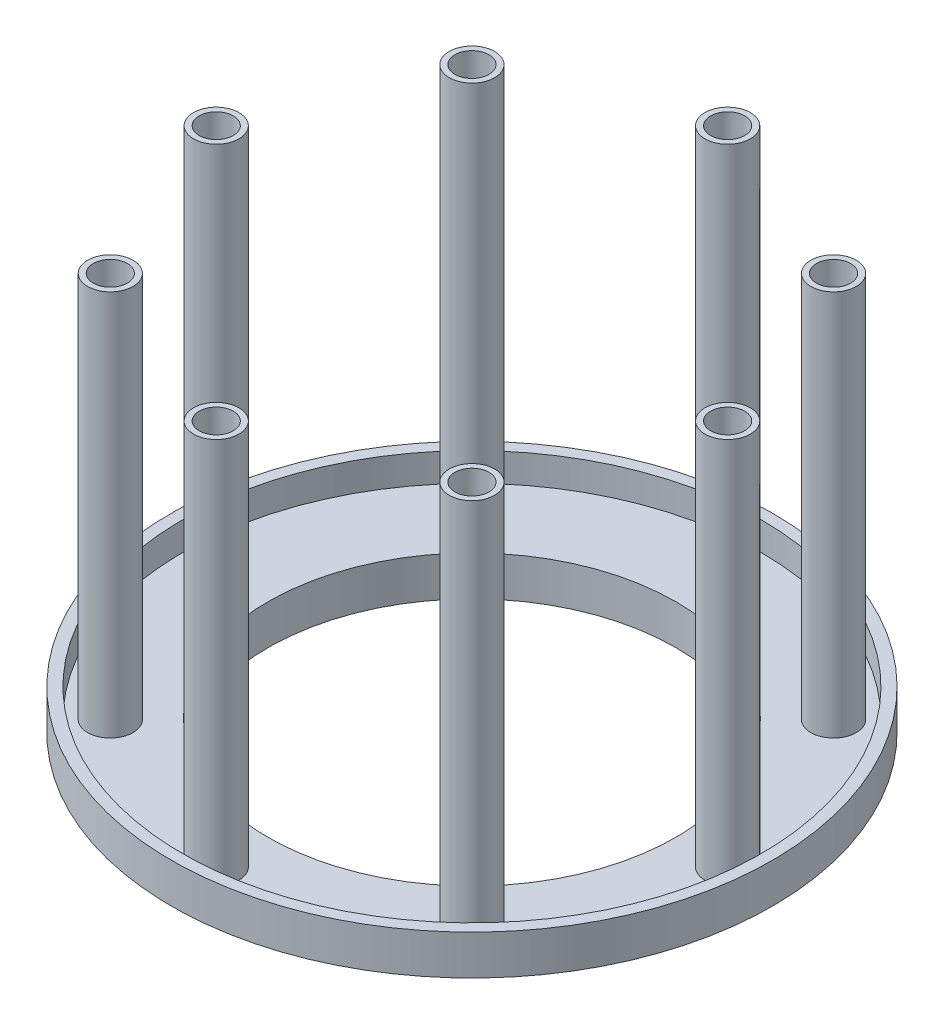
from build123d import *

# Parameters (mm, degrees)
IZIM2_R                        = 4
KES_EKSTR_ZYON1_DEPTH          = 10
PAH1_SIZE                      = 0.5
DAIRESEL_KAPLAMA8_COUNT        = 8
PAH1_OF_DAIRESEL_KAPLAMA8_SIZE = 0.5
IZIM4_R                        = 4
IZIM4_R_2                      = 3
Y_KSEKLIK_EKSTR_ZYON2_DEPTH    = 70


with BuildPart() as part:
    # Çizim1 → Döndür1 (revolve)
    with BuildSketch(Plane.XY, mode=Mode.PRIVATE) as d_nd_r1_sk:
        Polygon((-52.9, 7), (-52.9, 0), (-37.9, 0), (-37.9, -5), (-35.9, -5), (-35.9, 2), (-50.9, 2), (-50.9, 7), align=None)
    revolve(d_nd_r1_sk.sketch.rotate(Axis((0, 0, 0), (0, 1, 0)), 270), axis=Axis((0, 0, 0), (0, 1, 0)))

    # Çizim2 → Kes-Ekstrüzyon1 (cut)
    with BuildSketch(Plane.XZ):
        with Locations(Location((0, 45, 0), (0, 0, 270))):
            Circle(IZIM2_R)
    kes_ekstr_zyon1 = extrude(amount=-KES_EKSTR_ZYON1_DEPTH, mode=Mode.SUBTRACT)

    # Pah1
    pah1_edges = [part.edges().sort_by_distance(p)[0] for p in [
        (0, 0, 49),
    ]]
    chamfer(pah1_edges, length=PAH1_SIZE)

    # Dairesel Kaplama8: Kes-Ekstrüzyon1 ×8 about axis
    dairesel_kaplama8_axis = Axis((0, 0, 0), (0, 1, 0))
    for i in range(1, DAIRESEL_KAPLAMA8_COUNT):
        add(kes_ekstr_zyon1.rotate(dairesel_kaplama8_axis, i * 360 / DAIRESEL_KAPLAMA8_COUNT), mode=Mode.SUBTRACT)

    # Pah1 of Dairesel Kaplama8
    pah1_of_dairesel_kaplama8_edges = [part.edges().sort_by_distance(p)[0] for p in [
        (34.648232278, 0, 34.648232278),
        (49, 0, 0),
        (34.648232278, 0, -34.648232278),
        (0, 0, -49),
        (-34.648232278, 0, -34.648232278),
        (-49, 0, 0),
        (-34.648232278, 0, 34.648232278),
    ]]
    chamfer(pah1_of_dairesel_kaplama8_edges, length=PAH1_OF_DAIRESEL_KAPLAMA8_SIZE)

    # Çizim4 → Yükseklik-Ekstrüzyon2 (add)
    # profile 1 of 8: a face of its own
    with BuildSketch(Plane.XZ):
        with Locations(Location((0, 45, 0), (0, 0, 270))):
            Circle(IZIM4_R)
        with Locations(Location((0, 45, 0), (0, 0, 270))):
            Circle(IZIM4_R_2, mode=Mode.SUBTRACT)
    # profile 2 of 8: a face of its own
    with BuildSketch(Plane.XZ):
        with Locations(Location((31.819805153, 31.819805153, 0), (0, 0, 270))):
            Circle(IZIM4_R)
        with Locations(Location((31.819805153, 31.819805153, 0), (0, 0, 270))):
            Circle(IZIM4_R_2, mode=Mode.SUBTRACT)
    # profile 3 of 8: a face of its own
    with BuildSketch(Plane.XZ):
        with Locations(Location((45, 0, 0), (0, 0, 270))):
            Circle(IZIM4_R)
        with Locations(Location((45, 0, 0), (0, 0, 270))):
            Circle(IZIM4_R_2, mode=Mode.SUBTRACT)
    # profile 4 of 8: a face of its own
    with BuildSketch(Plane.XZ):
        with Locations(Location((31.819805153, -31.819805153, 0), (0, 0, 270))):
            Circle(IZIM4_R)
        with Locations(Location((31.819805153, -31.819805153, 0), (0, 0, 270))):
            Circle(IZIM4_R_2, mode=Mode.SUBTRACT)
    # profile 5 of 8: a face of its own
    with BuildSketch(Plane.XZ):
        with Locations(Location((0, -45, 0), (0, 0, 270))):
            Circle(IZIM4_R)
        with Locations(Location((0, -45, 0), (0, 0, 270))):
            Circle(IZIM4_R_2, mode=Mode.SUBTRACT)
    # profile 6 of 8: a face of its own
    with BuildSketch(Plane.XZ):
        with Locations(Location((-31.819805153, -31.819805153, 0), (0, 0, 270))):
            Circle(IZIM4_R)
        with Locations(Location((-31.819805153, -31.819805153, 0), (0, 0, 270))):
            Circle(IZIM4_R_2, mode=Mode.SUBTRACT)
    # profile 7 of 8: a face of its own
    with BuildSketch(Plane.XZ):
        with Locations(Location((-45, 0, 0), (0, 0, 270))):
            Circle(IZIM4_R)
        with Locations(Location((-45, 0, 0), (0, 0, 270))):
            Circle(IZIM4_R_2, mode=Mode.SUBTRACT)
    # profile 8 of 8: a face of its own
    with BuildSketch(Plane.XZ):
        with Locations(Location((-31.819805153, 31.819805153, 0), (0, 0, 270))):
            Circle(IZIM4_R)
        with Locations(Location((-31.819805153, 31.819805153, 0), (0, 0, 270))):
            Circle(IZIM4_R_2, mode=Mode.SUBTRACT)
    extrude(amount=-Y_KSEKLIK_EKSTR_ZYON2_DEPTH)


solid = part.part
